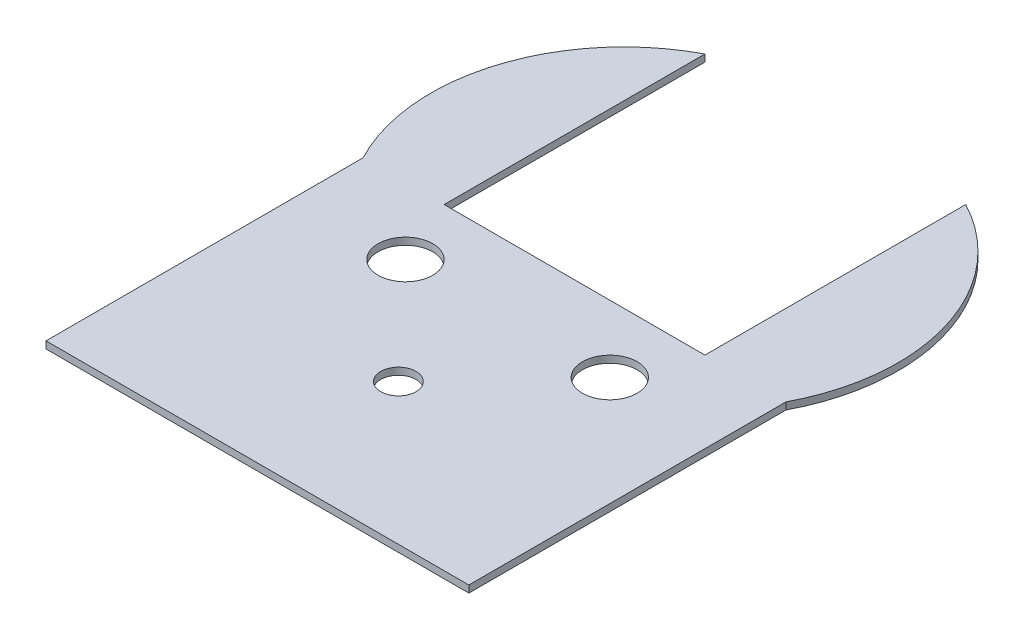
from build123d import *

# Parameters (mm, degrees)
BOSS_EXTRUDE1_DEPTH = 1
SKETCH2_R           = 2.5
CUT_EXTRUDE1_DEPTH  = 20
SKETCH3_W           = 5
SKETCH3_H           = 5
CUT_EXTRUDE2_DEPTH  = 10
SKETCH4_R           = 3.881431072
CUT_EXTRUDE3_DEPTH  = 10


with BuildPart() as part:
    # Sketch1 → Boss-Extrude1 (new body)
    with BuildSketch(Plane(origin=(0, 0, 0), x_dir=(1, 0, 0), z_dir=(0, 1, 0))):
        with BuildLine():
            Line((-19.801702617, 0), (17.198297383, 0))
            Line((17.198297383, 0), (17.198297383, 37))
            ThreePointArc((17.198297383, 37), (30.611248287, 20.881727984), (28.698297383, 0))
            Line((28.698297383, 0), (28.698297383, -45))
            Line((28.698297383, -45), (-31.301702617, -45))
            Line((-31.301702617, -45), (-31.301702617, 0))
            ThreePointArc((-31.301702617, 0), (-33.214653521, 20.881727984), (-19.801702617, 37))
            Line((-19.801702617, 37), (-19.801702617, 0))
        make_face()
    extrude(amount=BOSS_EXTRUDE1_DEPTH)

    # Sketch2 → Cut-Extrude1 (cut)
    with BuildSketch(Plane(origin=(0, 1, 0), x_dir=(1, 0, 0), z_dir=(0, 1, 0))):
        with Locations(Location((-1.301702617, -25, 0), (0, 0, 270))):
            Circle(SKETCH2_R)
    extrude(amount=-CUT_EXTRUDE1_DEPTH, mode=Mode.SUBTRACT)

    # Sketch3 → Cut-Extrude2 (cut)
    with BuildSketch(Plane.XZ):
        with Locations((13.198297383, 9.5)):
            Rectangle(SKETCH3_W, SKETCH3_H)
        with Locations((-15.801702617, 9.5)):
            Rectangle(SKETCH3_W, SKETCH3_H)
    extrude(amount=-CUT_EXTRUDE2_DEPTH, mode=Mode.SUBTRACT)

    # Sketch4 → Cut-Extrude3 (cut)
    with BuildSketch(Plane.XZ):
        with Locations(Location((13.198297383, 9.5, 0), (0, 0, 270))):
            Circle(SKETCH4_R)
        with Locations(Location((-15.801702617, 9.5, 0), (0, 0, 90))):
            Circle(SKETCH4_R)
    extrude(amount=-CUT_EXTRUDE3_DEPTH, mode=Mode.SUBTRACT)


solid = part.part
